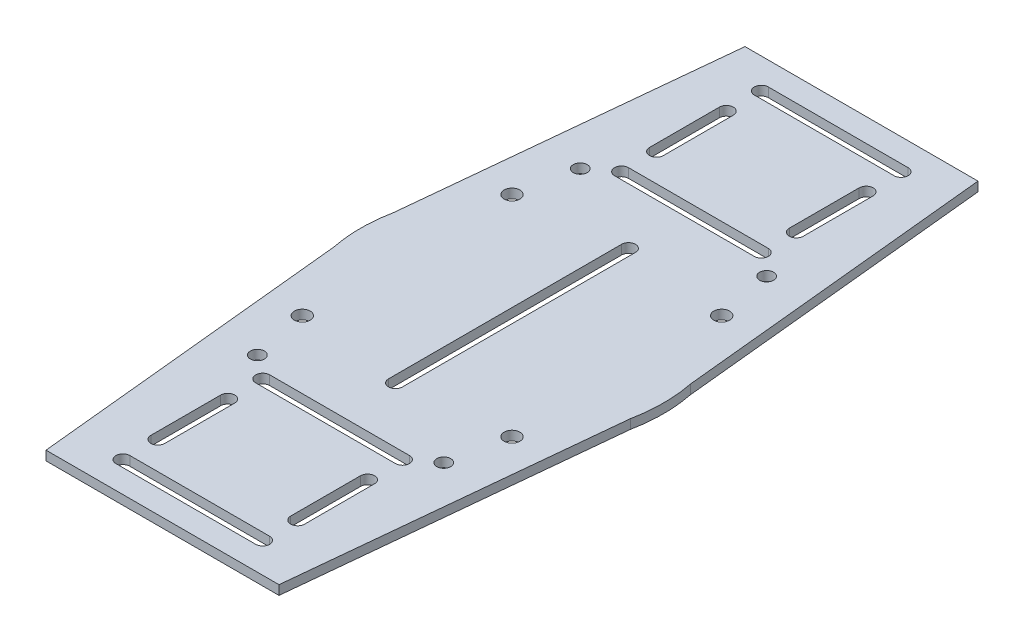
from build123d import *

# Parameters (mm, degrees)
SKETCH1_R                = 1.5
BOSS_EXTRUDE1_DEPTH      = 2
CUT_EXTRUDE1_DEPTH       = 2
M3_CLEARANCE_HOLE1_D     = 3.4
M3_CLEARANCE_HOLE1_DEPTH = 10
M3_CLEARANCE_HOLE1_TIP   = 1.021463052
CUT_EXTRUDE4_DEPTH       = 10


with BuildPart() as part:
    # Sketch1 → Boss-Extrude1 (new body)
    with BuildSketch(Plane(origin=(0, 0, 0), x_dir=(1, 0, 0), z_dir=(0, 1, 0))):
        with BuildLine():
            Line((-31.856435644, 6.435643564), (-25, 75))
            Line((-25, 75), (25, 75))
            Line((25, 75), (31.856435644, 6.435643564))
            ThreePointArc((31.856435644, 6.435643564), (32.5, 0), (31.856435644, -6.435643564))
            Line((31.856435644, -6.435643564), (25, -75))
            Line((25, -75), (-25, -75))
            Line((-25, -75), (-31.856435644, -6.435643564))
            ThreePointArc((-31.856435644, -6.435643564), (-32.5, 0), (-31.856435644, 6.435643564))
        make_face()
        with Locations(Location((-20, 34.641016151, 0), (0, 0, 270))):
            Circle(SKETCH1_R, mode=Mode.SUBTRACT)
        with Locations(Location((20, 34.641016151, 0), (0, 0, 90))):
            Circle(SKETCH1_R, mode=Mode.SUBTRACT)
        with Locations(Location((20, -34.641016151, 0), (0, 0, 270))):
            Circle(SKETCH1_R, mode=Mode.SUBTRACT)
        with Locations(Location((-20, -34.641016151, 0), (0, 0, 90))):
            Circle(SKETCH1_R, mode=Mode.SUBTRACT)
    extrude(amount=BOSS_EXTRUDE1_DEPTH)

    # Sketch2 → Cut-Extrude1 (cut)
    with BuildSketch(Plane(origin=(0, 2, 0), x_dir=(1, 0, 0), z_dir=(0, 1, 0))):
        with BuildLine():
            Line((-15, 70), (15, 70))
            ThreePointArc((15, 70), (16.5, 68.5), (15, 67))
            Line((15, 67), (-15, 67))
            ThreePointArc((-15, 67), (-16.5, 68.5), (-15, 70))
        make_face()
        with BuildLine():
            Line((-15, -70), (15, -70))
            ThreePointArc((15, -70), (16.5, -68.5), (15, -67))
            Line((15, -67), (-15, -67))
            ThreePointArc((-15, -67), (-16.5, -68.5), (-15, -70))
        make_face()
        with BuildLine():
            Line((-15, 37), (15, 37))
            ThreePointArc((15, 37), (16.5, 38.5), (15, 40))
            Line((15, 40), (-15, 40))
            ThreePointArc((-15, 40), (-16.5, 38.5), (-15, 37))
        make_face()
        with BuildLine():
            Line((-15, -37), (15, -37))
            ThreePointArc((15, -37), (16.5, -38.5), (15, -40))
            Line((15, -40), (-15, -40))
            ThreePointArc((-15, -40), (-16.5, -38.5), (-15, -37))
        make_face()
        with BuildLine():
            Line((1.5, 25), (1.5, -25))
            ThreePointArc((1.5, -25), (0, -26.5), (-1.5, -25))
            Line((-1.5, -25), (-1.5, 25))
            ThreePointArc((-1.5, 25), (0, 26.5), (1.5, 25))
        make_face()
    extrude(amount=-CUT_EXTRUDE1_DEPTH, mode=Mode.SUBTRACT)

    # M3 Clearance Hole1
    with Locations(Plane(origin=(-22.5, 2, -22.5), x_dir=(0, 0, 1), z_dir=(0, 1, 0))):
        with Locations((0, 0), (0, 45), (45, 45), (45, 0)):
            Hole(M3_CLEARANCE_HOLE1_D / 2, depth=M3_CLEARANCE_HOLE1_DEPTH)
            with Locations((0, 0, -(M3_CLEARANCE_HOLE1_DEPTH + M3_CLEARANCE_HOLE1_TIP / 2))):  # 118° drill point
                Cone(0, M3_CLEARANCE_HOLE1_D / 2, M3_CLEARANCE_HOLE1_TIP, mode=Mode.SUBTRACT)

    # Sketch11 → Cut-Extrude4 (cut)
    with BuildSketch(Plane(origin=(0, 2, 0), x_dir=(1, 0, 0), z_dir=(0, 1, 0))):
        with BuildLine():
            Line((16.5, -46), (16.5, -61))
            ThreePointArc((16.5, -61), (15, -62.5), (13.5, -61))
            Line((13.5, -61), (13.5, -46))
            ThreePointArc((13.5, -46), (15, -44.5), (16.5, -46))
        make_face()
        with BuildLine():
            Line((-16.5, -46), (-16.5, -61))
            ThreePointArc((-16.5, -61), (-15, -62.5), (-13.5, -61))
            Line((-13.5, -61), (-13.5, -46))
            ThreePointArc((-13.5, -46), (-15, -44.5), (-16.5, -46))
        make_face()
        with BuildLine():
            Line((-16.5, 46), (-16.5, 61))
            ThreePointArc((-16.5, 61), (-15, 62.5), (-13.5, 61))
            Line((-13.5, 61), (-13.5, 46))
            ThreePointArc((-13.5, 46), (-15, 44.5), (-16.5, 46))
        make_face()
        with BuildLine():
            Line((16.5, 46), (16.5, 61))
            ThreePointArc((16.5, 61), (15, 62.5), (13.5, 61))
            Line((13.5, 61), (13.5, 46))
            ThreePointArc((13.5, 46), (15, 44.5), (16.5, 46))
        make_face()
    extrude(amount=-CUT_EXTRUDE4_DEPTH, mode=Mode.SUBTRACT)


solid = part.part
